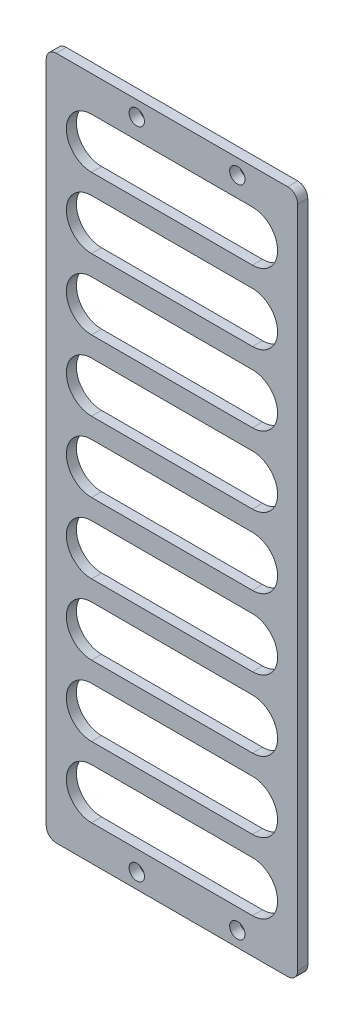
from build123d import *

# Parameters (mm, degrees)
SKETCH_1_W             = 50
SKETCH_1_H             = 136
EXTRUDE_1_DEPTH        = 2
SKETCH_3_R             = 1.525
CUT_EXTRUDE_1_DEPTH    = 10
CUT_EXTRUDE_2_DEPTH    = 22
PATTERN_LINEAR_1_COUNT = 5
PATTERN_LINEAR_1_PITCH = 14
MIRROR_2_COPY_1_DEPTH  = 22
MIRROR_2_COPY_2_DEPTH  = 22
MIRROR_2_COPY_3_DEPTH  = 22
MIRROR_2_COPY_4_DEPTH  = 22
MIRROR_2_COPY_5_DEPTH  = 22
FILLET_1_R             = 2


with BuildPart() as part:
    # 草图1 → 凸台-拉伸1 (new body)
    with BuildSketch(Plane.XY):
        Rectangle(SKETCH_1_W, SKETCH_1_H)
    extrude(amount=EXTRUDE_1_DEPTH)

    # 草图3 → 切除-拉伸1 (cut)
    with BuildSketch(Plane(origin=(0, 0, 0), x_dir=(-1, 0, 0), z_dir=(0, 0, -1))):
        with Locations((-13, 65)):
            Circle(SKETCH_3_R)
        with Locations((7, 65)):
            Circle(SKETCH_3_R)
    cut_extrude_1 = extrude(amount=-CUT_EXTRUDE_1_DEPTH, mode=Mode.SUBTRACT)

    # 镜向1: 切除-拉伸1 across plane
    add(cut_extrude_1.mirror(Plane.ZX), mode=Mode.SUBTRACT)

    # 草图4 → 切除-拉伸2 (cut)
    with BuildSketch(Plane(origin=(0, 0, 0), x_dir=(-1, 0, 0), z_dir=(0, 0, -1))):
        with BuildLine():
            Line((16, -5), (-16, -5))
            ThreePointArc((-16, -5), (-21, 0), (-16, 5))
            Line((-16, 5), (16, 5))
            ThreePointArc((16, 5), (21, 0), (16, -5))
        make_face()
    cut_extrude_2 = extrude(amount=-CUT_EXTRUDE_2_DEPTH, mode=Mode.SUBTRACT)

    # 阵列(线性)1: 切除-拉伸2 ×5
    with Locations(*[(0, -i * PATTERN_LINEAR_1_PITCH, 0) for i in range(1, PATTERN_LINEAR_1_COUNT)]):
        add(cut_extrude_2, mode=Mode.SUBTRACT)

    # 镜向2 copy 1 sketch → 镜向2 copy 1 (cut)
    with BuildSketch(Plane(origin=(0, 14, 0), x_dir=(-1, 0, 0), z_dir=(0, 0, -1))):
        with BuildLine():
            Line((16, 5), (-16, 5))
            ThreePointArc((-16, 5), (-21, 0), (-16, -5))
            Line((-16, -5), (16, -5))
            ThreePointArc((16, -5), (21, 0), (16, 5))
        make_face()
    extrude(amount=-MIRROR_2_COPY_1_DEPTH, mode=Mode.SUBTRACT)

    # 镜向2 copy 2 sketch → 镜向2 copy 2 (cut)
    with BuildSketch(Plane(origin=(0, 28, 0), x_dir=(-1, 0, 0), z_dir=(0, 0, -1))):
        with BuildLine():
            Line((16, 5), (-16, 5))
            ThreePointArc((-16, 5), (-21, 0), (-16, -5))
            Line((-16, -5), (16, -5))
            ThreePointArc((16, -5), (21, 0), (16, 5))
        make_face()
    extrude(amount=-MIRROR_2_COPY_2_DEPTH, mode=Mode.SUBTRACT)

    # 镜向2 copy 3 sketch → 镜向2 copy 3 (cut)
    with BuildSketch(Plane(origin=(0, 42, 0), x_dir=(-1, 0, 0), z_dir=(0, 0, -1))):
        with BuildLine():
            Line((16, 5), (-16, 5))
            ThreePointArc((-16, 5), (-21, 0), (-16, -5))
            Line((-16, -5), (16, -5))
            ThreePointArc((16, -5), (21, 0), (16, 5))
        make_face()
    extrude(amount=-MIRROR_2_COPY_3_DEPTH, mode=Mode.SUBTRACT)

    # 镜向2 copy 4 sketch → 镜向2 copy 4 (cut)
    with BuildSketch(Plane(origin=(0, 56, 0), x_dir=(-1, 0, 0), z_dir=(0, 0, -1))):
        with BuildLine():
            Line((16, 5), (-16, 5))
            ThreePointArc((-16, 5), (-21, 0), (-16, -5))
            Line((-16, -5), (16, -5))
            ThreePointArc((16, -5), (21, 0), (16, 5))
        make_face()
    extrude(amount=-MIRROR_2_COPY_4_DEPTH, mode=Mode.SUBTRACT)

    # 镜向2 copy 5 sketch → 镜向2 copy 5 (cut)
    with BuildSketch(Plane(origin=(0, 0, 0), x_dir=(-1, 0, 0), z_dir=(0, 0, -1))):
        with BuildLine():
            Line((16, 5), (-16, 5))
            ThreePointArc((-16, 5), (-21, 0), (-16, -5))
            Line((-16, -5), (16, -5))
            ThreePointArc((16, -5), (21, 0), (16, 5))
        make_face()
    extrude(amount=-MIRROR_2_COPY_5_DEPTH, mode=Mode.SUBTRACT)

    # 圆角1
    fillet_1_edges = [part.edges().sort_by_distance(p)[0] for p in [
        (25, -68, 1),
        (-25, -68, 1),
        (-25, 68, 1),
        (25, 68, 1),
    ]]
    fillet(fillet_1_edges, radius=FILLET_1_R)


solid = part.part
